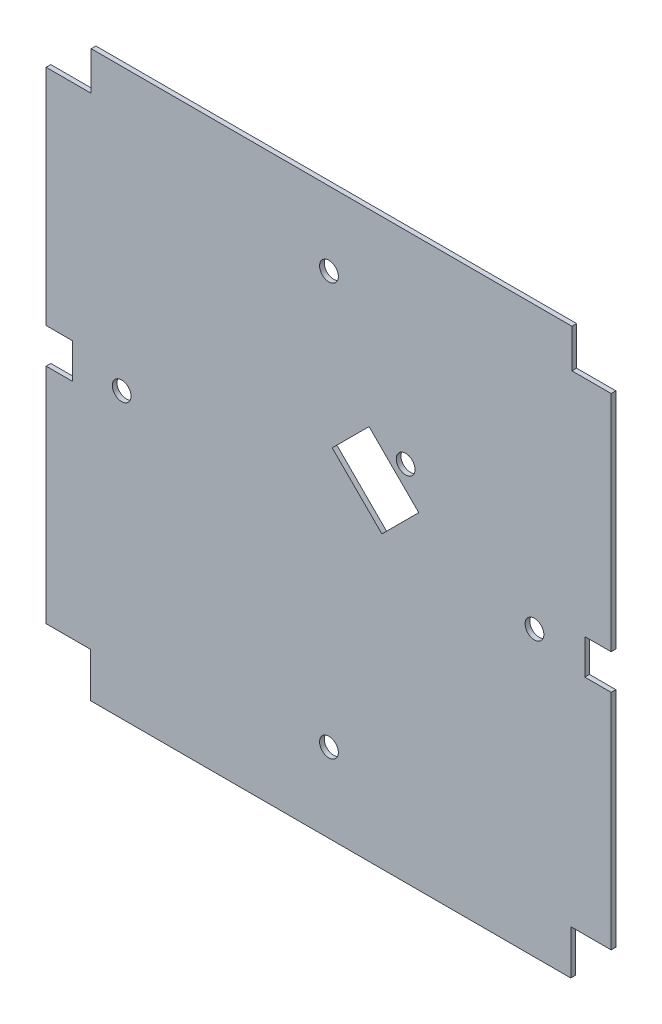
from build123d import *

# Parameters (mm, degrees)
SKETCH1_R           = 1.6
BOSS_EXTRUDE1_DEPTH = 0.8
CUT_EXTRUDE1_DEPTH  = 0.8


with BuildPart() as part:
    # Sketch1 → Boss-Extrude1 (new body)
    with BuildSketch(Plane.XY):
        Polygon((22.775267328, 35.726963173), (-59.324732672, 35.726963173), (-59.324732672, 29.126963173), (-67.024732672, 29.126963173), (-67.024732672, -9.073036827), (-62.524732672, -9.073036827), (-62.524732672, -15.073036827), (-67.024732672, -15.073036827), (-67.024732672, -53.173036827), (-59.424732672, -53.173036827), (-59.424732672, -60.773036827), (22.575267328, -60.773036827), (22.575267328, -53.173036827), (29.475267328, -53.173036827), (29.475267328, -15.073036827), (24.975267328, -15.073036827), (24.975267328, -9.073036827), (29.475267328, -9.073036827), (29.475267328, 29.126963173), (22.775267328, 29.126963173), align=None)
        with Locations((-18.724732672, -47.273036827)):
            Circle(SKETCH1_R, mode=Mode.SUBTRACT)
        with Locations((-54.124732672, -12.273036827)):
            Circle(SKETCH1_R, mode=Mode.SUBTRACT)
        with Locations((-5.624732672, 1.126963173)):
            Circle(SKETCH1_R, mode=Mode.SUBTRACT)
        with Locations((16.375267328, -12.273036827)):
            Circle(SKETCH1_R, mode=Mode.SUBTRACT)
        with Locations((-18.724732672, 23.126963173)):
            Circle(SKETCH1_R, mode=Mode.SUBTRACT)
    extrude(amount=BOSS_EXTRUDE1_DEPTH)

    # Sketch2 → Cut-Extrude1 (cut)
    with BuildSketch(Plane.XY.offset(0.8)):
        Polygon((-7.931660886, -9.465246416), (-16.416942261, -0.979965042), (-18.169105872, -2.732128653), (-9.683824497, -11.217410027), align=None)
        Polygon((-5.032523083, -6.566108613), (-13.517804458, 1.919172761), (-16.416942261, -0.979965042), (-7.931660886, -9.465246416), align=None)
        Polygon((-3.390574145, -4.924159675), (-11.875855519, 3.5611217), (-13.517804458, 1.919172761), (-5.032523083, -6.566108613), align=None)
    extrude(amount=-CUT_EXTRUDE1_DEPTH, mode=Mode.SUBTRACT)


solid = part.part
